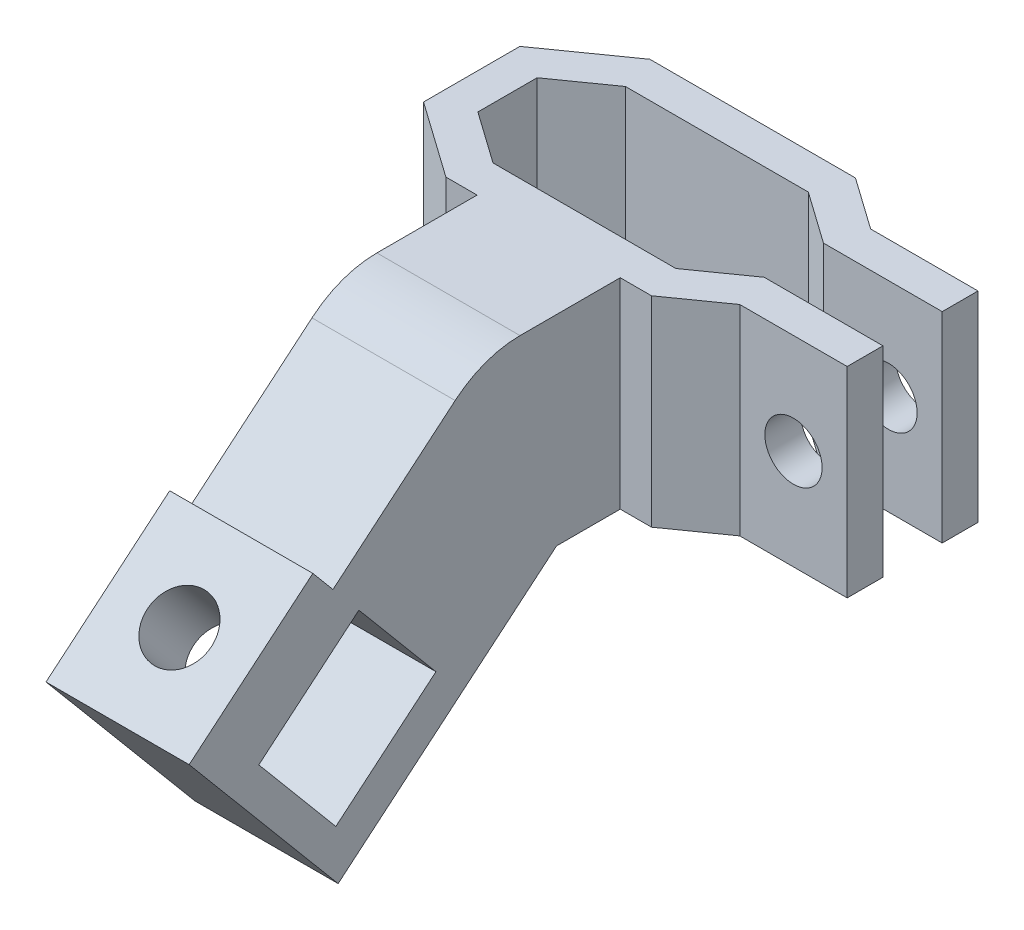
from build123d import *

# Parameters (mm, degrees)
BOSS_EXTRUDE1_DEPTH = 14.224
SKETCH2_W           = 10.16
SKETCH2_H           = 14.224
BOSS_EXTRUDE2_DEPTH = 7.112
SKETCH3_W           = 10.16
SKETCH3_H           = 7.112
REVOLVE2_ANGLE      = 180
CUT_EXTRUDE2_REACH  = 37.062
SKETCH5_R           = 2.032
BOSS_EXTRUDE4_DEPTH = 10.16
SKETCH8_R           = 2.286
CUT_EXTRUDE3_DEPTH  = 5.08


with BuildPart() as part:
    # Sketch1 → Boss-Extrude1 (new body)
    with BuildSketch(Plane(origin=(0, 0, 0), x_dir=(1, 0, 0), z_dir=(0, 1, 0))):
        Polygon((-6.487826296, -4.699), (6.487826296, -4.699), (10.16, -2.102598059), (18.587251519, -2.102598059), (18.587251519, -4.642598059), (10.967251519, -4.642598059), (7.295077814, -7.239), (-7.295077814, -7.239), (-12.7, -3.417462245), (-12.7, 3.417462245), (-7.295077814, 7.239), (7.295077814, 7.239), (10.967251519, 4.642598059), (18.587251519, 4.642598059), (18.587251519, 2.102598059), (10.16, 2.102598059), (6.487826296, 4.699), (-6.487826296, 4.699), (-10.16, 2.102598059), (-10.16, -2.102598059), align=None)
    extrude(amount=BOSS_EXTRUDE1_DEPTH)

    # Sketch2 → Boss-Extrude2 (add)
    with BuildSketch(Plane.XY.offset(7.239)):
        with Locations((0, 7.112)):
            Rectangle(SKETCH2_W, SKETCH2_H)
    extrude(amount=BOSS_EXTRUDE2_DEPTH)

    # Sketch3 → Revolve2 (revolve)
    with BuildSketch(Plane.XY.offset(14.351)):
        with Locations((0, 10.668)):
            Rectangle(SKETCH3_W, SKETCH3_H)
    revolve(axis=Axis((-5.08, 7.112, 14.351), (1, 0, 0)), revolution_arc=REVOLVE2_ANGLE)

    # Cut-Extrude2: up to this face of the body (flat: up to its plane)
    cut_extrude2_end = Plane(part.part.faces().sort_by_distance((14.777251519, 7.112, 4.642598059))[0])
    # Sketch5 → Cut-Extrude2 (cut, up to the picked face)
    with BuildSketch(Plane(origin=(0, 0, -4.642598059), x_dir=(-1, 0, 0), z_dir=(0, 0, -1)), mode=Mode.PRIVATE) as cut_extrude2_sk1:
        with Locations((-14.777251519, 7.112)):
            Circle(SKETCH5_R)
    cut_extrude2_tool1 = split(extrude(cut_extrude2_sk1.sketch, amount=-CUT_EXTRUDE2_REACH, mode=Mode.PRIVATE), bisect_by=cut_extrude2_end, keep=Keep.BOTH, mode=Mode.PRIVATE)
    add(cut_extrude2_tool1.solids().sort_by(Axis((14.777252, 7.112, -4.642598), (0, 0, 1)))[0], mode=Mode.SUBTRACT)

    # Sketch7 → Boss-Extrude4 (add)
    with BuildSketch(Plane(origin=(5.08, 0, 0), x_dir=(0, 0, -1), z_dir=(1, 0, 0))):
        Polygon((-27.259989759, -13.003831416), (-36.402849284, -2.10779573), (-37.831520464, -0.405171719), (-29.054109682, 6.959950431), (-27.625438502, 5.25732642), (-18.891073315, 12.586329027), (-9.748213789, 1.690293341), align=None)
        Polygon((-27.421266886, -9.409111436), (-32.890746657, -2.890839269), (-25.788748625, 3.06844466), (-20.319268854, -3.449827506), align=None, mode=Mode.SUBTRACT)
    extrude(amount=-BOSS_EXTRUDE4_DEPTH)

    # Sketch8 → Cut-Extrude3 (cut)
    with BuildSketch(Plane(origin=(0, 18.390622806, 15.431564813), x_dir=(1, 0, 0), z_dir=(0, 0.7660444431189808, 0.642787609686536))):
        with Locations(Location((0, -23.512017379, 0), (0, 0, 270))):
            Circle(SKETCH8_R)
    extrude(amount=-CUT_EXTRUDE3_DEPTH, mode=Mode.SUBTRACT)


solid = part.part
